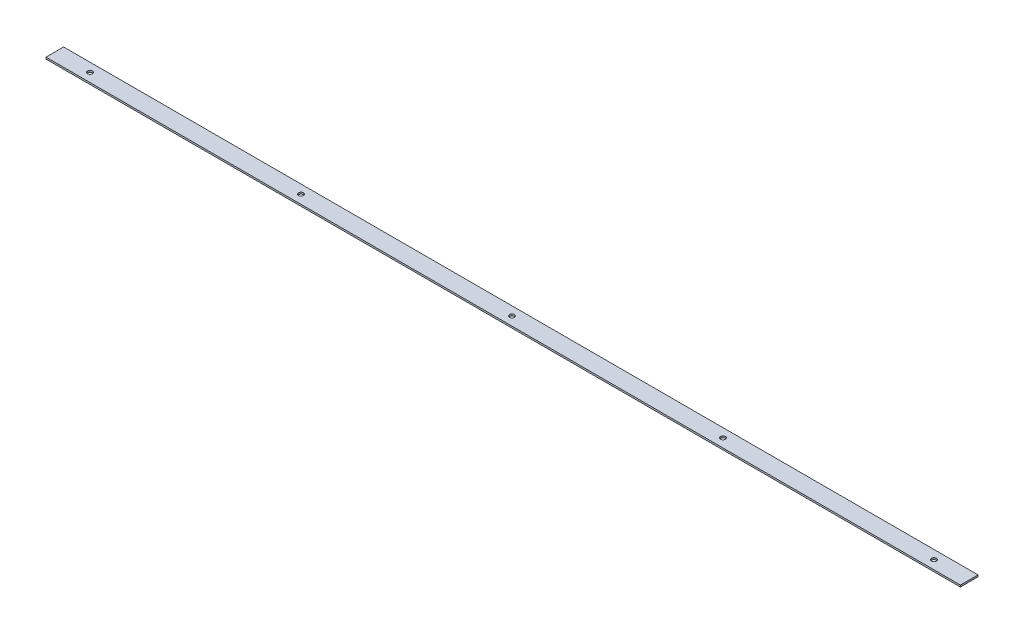
from build123d import *

# Parameters (mm, degrees)
SKETCH1_W           = 1300
SKETCH1_H           = 25
BOSS_EXTRUDE1_DEPTH = 2.5
SKETCH2_R           = 3.5
CUT_EXTRUDE1_DEPTH  = 651.124987983
LPATTERN1_COUNT     = 5
LPATTERN1_PITCH     = 300


with BuildPart() as part:
    # Sketch1 → Boss-Extrude1 (new body)
    with BuildSketch(Plane(origin=(0, 0, 0), x_dir=(1, 0, 0), z_dir=(0, 1, 0))):
        Rectangle(SKETCH1_W, SKETCH1_H)
    extrude(amount=BOSS_EXTRUDE1_DEPTH)

    # Sketch2 → Cut-Extrude1 (cut, symmetric)
    with BuildSketch(Plane(origin=(0, 2.5, 0), x_dir=(1, 0, 0), z_dir=(0, 1, 0))):
        with Locations(Location((-600, 0, 0), (0, 0, 270))):
            Circle(SKETCH2_R)
    cut_extrude1 = extrude(amount=CUT_EXTRUDE1_DEPTH, both=True, mode=Mode.SUBTRACT)

    # LPattern1: Cut-Extrude1 ×5
    with Locations(*[(i * LPATTERN1_PITCH, 0, 0) for i in range(1, LPATTERN1_COUNT)]):
        add(cut_extrude1, mode=Mode.SUBTRACT)


solid = part.part
